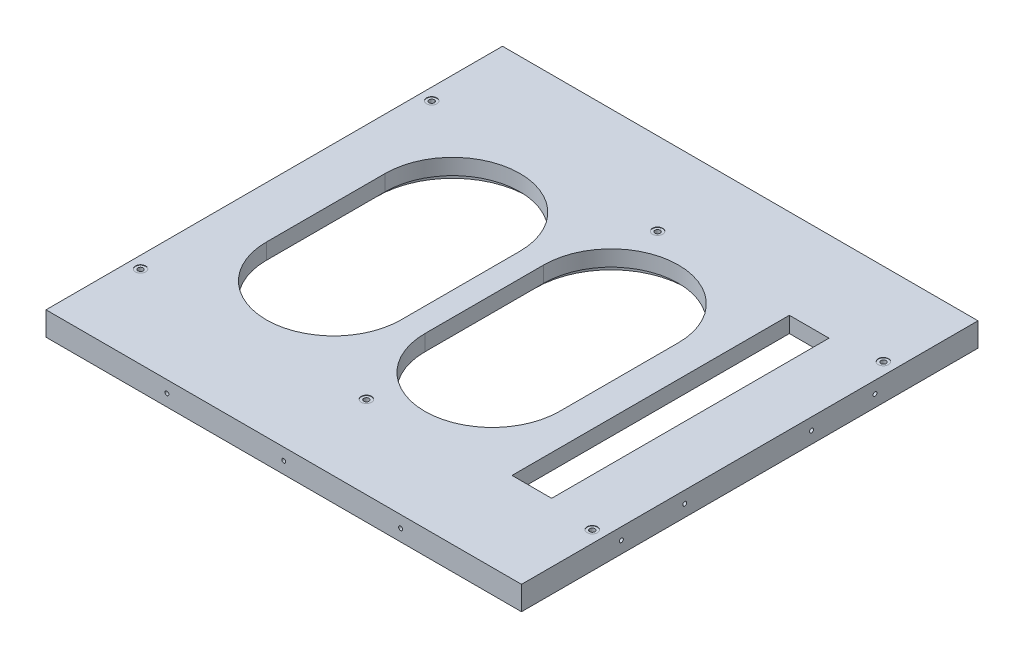
from build123d import *

# Parameters (mm, degrees)
SKETCH_1_W                     = 600
SKETCH_1_H                     = 576
EXTRUDE_1_DEPTH                = 30
SKETCH_2_W                     = 70
SKETCH_2_H                     = 370
CUT_EXTRUDE_1_DEPTH            = 10
SKETCH_3_W                     = 50
SKETCH_3_H                     = 350
CUT_EXTRUDE_2_DEPTH            = 417.346009948
HOLE_WIZARD_M6_1_D             = 6
HOLE_WIZARD_M6_1_DEPTH         = 17
HOLE_WIZARD_M6_1_TIP           = 1.802581857
HOLE_WIZARD_M6_2_AT_2_COUNT    = 2
HOLE_WIZARD_M6_2_AT_2_PITCH    = 147.5
HOLE_WIZARD_M6_2_AT_3_COUNT    = 2
HOLE_WIZARD_M6_2_AT_3_PITCH    = 295
HOLE_WIZARD_M6_3_AT_2_COUNT    = 2
HOLE_WIZARD_M6_3_AT_2_PITCH    = 80
HOLE_WIZARD_M6_3_AT_3_COUNT    = 2
HOLE_WIZARD_M6_3_AT_3_PITCH    = 240
HOLE_WIZARD_M6_3_AT_4_COUNT    = 2
HOLE_WIZARD_M6_3_AT_4_PITCH    = 320
HOLE_WIZARD_M6_1_2_D           = 6.6
HOLE_WIZARD_M6_1_2_CBORE_D     = 13
HOLE_WIZARD_M6_1_2_CBORE_DEPTH = 0.5


with BuildPart() as part:
    # 草图1 → 凸台-拉伸1 (new body)
    with BuildSketch(Plane(origin=(0, 0, 0), x_dir=(1, 0, 0), z_dir=(0, 1, 0))):
        Rectangle(SKETCH_1_W, SKETCH_1_H)
    extrude(amount=EXTRUDE_1_DEPTH)

    # 草图2 → 切除-拉伸1 (cut)
    with BuildSketch(Plane.XZ):
        with BuildLine():
            Line((-245, 75), (-245, -75))
            ThreePointArc((-245, -75), (-150, -170), (-55, -75))
            Line((-55, -75), (-55, 75))
            ThreePointArc((-55, 75), (-150, 170), (-245, 75))
        make_face()
        with Locations((200, 0)):
            Rectangle(SKETCH_2_W, SKETCH_2_H)
        with BuildLine():
            Line((-45, 75), (-45, -75))
            ThreePointArc((-45, -75), (50, -170), (145, -75))
            Line((145, -75), (145, 75))
            ThreePointArc((145, 75), (50, 170), (-45, 75))
        make_face()
    extrude(amount=-CUT_EXTRUDE_1_DEPTH, mode=Mode.SUBTRACT)

    # 草图3 → 切除-拉伸2 (cut, through all)
    with BuildSketch(Plane.XZ.offset(-10)):
        with BuildLine():
            Line((-35, 75), (-35, -75))
            ThreePointArc((-35, -75), (50, -160), (135, -75))
            Line((135, -75), (135, 75))
            ThreePointArc((135, 75), (50, 160), (-35, 75))
        make_face()
        with BuildLine():
            Line((-65, 75), (-65, -75))
            ThreePointArc((-65, -75), (-150, -160), (-235, -75))
            Line((-235, -75), (-235, 75))
            ThreePointArc((-235, 75), (-150, 160), (-65, 75))
        make_face()
        with Locations((200, 0)):
            Rectangle(SKETCH_3_W, SKETCH_3_H)
    extrude(amount=-CUT_EXTRUDE_2_DEPTH, mode=Mode.SUBTRACT)

    # Hole Wizard M6 _1
    with Locations(Plane(origin=(0, 0, 0), x_dir=(-1, 0, 0), z_dir=(0, -1, 0))):
        with Locations((294, -264.5), (294, -223.5), (-294, -264.5), (-294, -223.5), (-294, 264.5), (-294, 223.5), (294, 223.5), (294, 264.5)):
            Hole(HOLE_WIZARD_M6_1_D / 2, depth=HOLE_WIZARD_M6_1_DEPTH)
            with Locations((0, 0, -(HOLE_WIZARD_M6_1_DEPTH + HOLE_WIZARD_M6_1_TIP / 2))):  # 118° drill point
                Cone(0, HOLE_WIZARD_M6_1_D / 2, HOLE_WIZARD_M6_1_TIP, mode=Mode.SUBTRACT)

    # 草图19 → M6 螺纹孔2 (revolve, cut)
    with BuildSketch(Plane(origin=(147.5, 15, -288), x_dir=(0, 1, 0), z_dir=(1, 0, 0))):
        Polygon((0, 0), (0, 11.502151548), (2.5, 10), (2.5, 0), align=None)
    hole_wizard_m6_2 = revolve(axis=Axis((147.5, 15, -294.35), (0, 0, 1)), mode=Mode.SUBTRACT)

    # M6 螺纹孔2 at 2: M6 螺纹孔2 ×2
    with Locations(*[(-i * HOLE_WIZARD_M6_2_AT_2_PITCH, 0, 0) for i in range(1, HOLE_WIZARD_M6_2_AT_2_COUNT)]):
        add(hole_wizard_m6_2, mode=Mode.SUBTRACT)

    # M6 螺纹孔2 at 3: M6 螺纹孔2 ×2
    with Locations(*[(-i * HOLE_WIZARD_M6_2_AT_3_PITCH, 0, 0) for i in range(1, HOLE_WIZARD_M6_2_AT_3_COUNT)]):
        add(hole_wizard_m6_2, mode=Mode.SUBTRACT)

    # 镜向1: M6 螺纹孔2 across plane
    add(hole_wizard_m6_2.mirror(Plane.XY), mode=Mode.SUBTRACT)

    # 镜向1 copy 1 sketch → 镜向1 copy 1 (revolve, cut)
    with BuildSketch(Plane(origin=(0, 15, 288), x_dir=(0, 1, 0), z_dir=(1, 0, 0))):
        Polygon((0, 0), (0, -11.502151548), (2.5, -10), (2.5, 0), align=None)
    revolve(axis=Axis((0, 15, 294.35), (0, 0, 1)), mode=Mode.SUBTRACT)

    # 镜向1 copy 2 sketch → 镜向1 copy 2 (revolve, cut)
    with BuildSketch(Plane(origin=(-147.5, 15, 288), x_dir=(0, 1, 0), z_dir=(1, 0, 0))):
        Polygon((0, 0), (0, -11.502151548), (2.5, -10), (2.5, 0), align=None)
    revolve(axis=Axis((-147.5, 15, 294.35), (0, 0, 1)), mode=Mode.SUBTRACT)

    # 草图22 → M6 螺纹孔3 (revolve, cut)
    with BuildSketch(Plane(origin=(-300, 15, -158), x_dir=(0, 0, 1), z_dir=(0, 1, 0))):
        Polygon((0, 0), (0, 16.502151548), (2.5, 15), (2.5, 0), align=None)
    hole_wizard_m6_3 = revolve(axis=Axis((-306.35, 15, -158), (1, 0, 0)), mode=Mode.SUBTRACT)

    # M6 螺纹孔3 at 2: M6 螺纹孔3 ×2
    with Locations(*[(0, 0, i * HOLE_WIZARD_M6_3_AT_2_PITCH) for i in range(1, HOLE_WIZARD_M6_3_AT_2_COUNT)]):
        add(hole_wizard_m6_3, mode=Mode.SUBTRACT)

    # M6 螺纹孔3 at 3: M6 螺纹孔3 ×2
    with Locations(*[(0, 0, i * HOLE_WIZARD_M6_3_AT_3_PITCH) for i in range(1, HOLE_WIZARD_M6_3_AT_3_COUNT)]):
        add(hole_wizard_m6_3, mode=Mode.SUBTRACT)

    # M6 螺纹孔3 at 4: M6 螺纹孔3 ×2
    with Locations(*[(0, 0, i * HOLE_WIZARD_M6_3_AT_4_PITCH) for i in range(1, HOLE_WIZARD_M6_3_AT_4_COUNT)]):
        add(hole_wizard_m6_3, mode=Mode.SUBTRACT)

    # 镜向2: M6 螺纹孔3 across plane
    add(hole_wizard_m6_3.mirror(Plane(origin=(0, 0, 0), x_dir=(0, 0, 1), z_dir=(1, 0, 0))), mode=Mode.SUBTRACT)

    # 镜向2 copy 1 sketch → 镜向2 copy 1 (revolve, cut)
    with BuildSketch(Plane(origin=(300, 15, -78), x_dir=(0, 0, 1), z_dir=(0, 1, 0))):
        Polygon((0, 0), (0, -16.502151548), (2.5, -15), (2.5, 0), align=None)
    revolve(axis=Axis((306.35, 15, -78), (1, 0, 0)), mode=Mode.SUBTRACT)

    # 镜向2 copy 2 sketch → 镜向2 copy 2 (revolve, cut)
    with BuildSketch(Plane(origin=(300, 15, 82), x_dir=(0, 0, 1), z_dir=(0, 1, 0))):
        Polygon((0, 0), (0, -16.502151548), (2.5, -15), (2.5, 0), align=None)
    revolve(axis=Axis((306.35, 15, 82), (1, 0, 0)), mode=Mode.SUBTRACT)

    # 镜向2 copy 3 sketch → 镜向2 copy 3 (revolve, cut)
    with BuildSketch(Plane(origin=(300, 15, 162), x_dir=(0, 0, 1), z_dir=(0, 1, 0))):
        Polygon((0, 0), (0, -16.502151548), (2.5, -15), (2.5, 0), align=None)
    revolve(axis=Axis((306.35, 15, 162), (1, 0, 0)), mode=Mode.SUBTRACT)

    # Hole Wizard M6 _1 2 (through all)
    with Locations(Plane(origin=(0, 30, 0), x_dir=(1, 0, 0), z_dir=(0, 1, 0))):
        with Locations((-285, 183.68), (0, 183.68), (285, 183.68), (-285, -183.68), (0, -183.68), (285, -183.68)):
            CounterBoreHole(HOLE_WIZARD_M6_1_2_D / 2, HOLE_WIZARD_M6_1_2_CBORE_D / 2, HOLE_WIZARD_M6_1_2_CBORE_DEPTH)


solid = part.part
